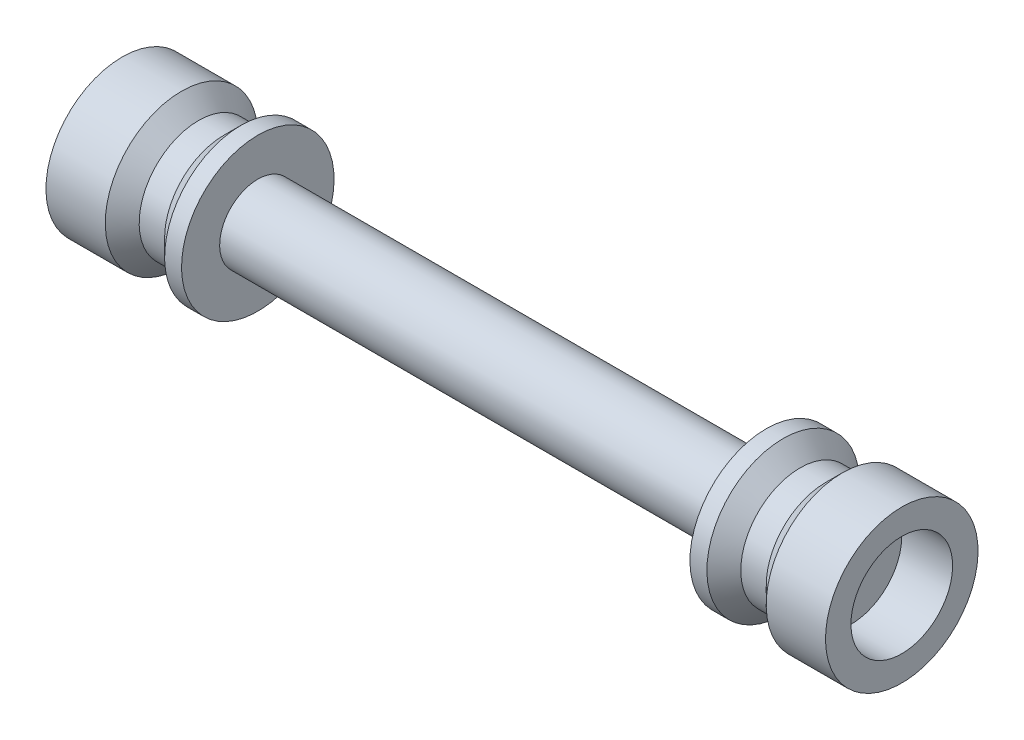
from build123d import *


with BuildPart() as part:
    # Esquisse1 → Revolution1 (revolve)
    with BuildSketch(Plane.XY):
        Polygon((0, 0), (-20, 0), (-20, 3), (-23, 3), (-23, 4.5), (-19.5, 4.5), (-18.5, 3.5), (-17, 3.5), (-16, 4.5), (-15, 4.5), (-15, 2.25), (15, 2.25), (15, 4.5), (16, 4.5), (17, 3.5), (18.5, 3.5), (19.5, 4.5), (23, 4.5), (23, 3), (20, 3), (20, 0), align=None)
    revolve(axis=Axis((0, 0, 0), (-1, 0, 0)))


solid = part.part
